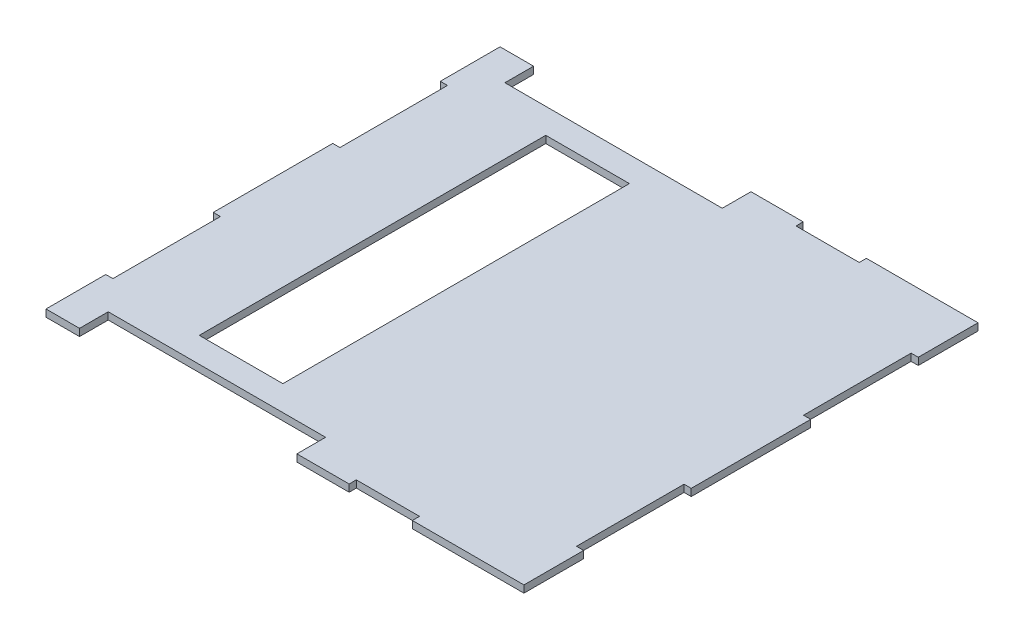
from build123d import *

# Parameters (mm, degrees)
SKETCH1_W               = 200
SKETCH1_H               = 190
BOSS_EXTRUDE1_DEPTH     = 3
CUT_EXTRUDE2_DEPTH      = 138.963763358
CUT_EXTRUDE2_DEPTH_BACK = 3
SKETCH2_OUTSIDE_W       = 257.176
SKETCH2_OUTSIDE_H       = 247.176
SKETCH3_W               = 35
SKETCH3_H               = 145
CUT_EXTRUDE3_DEPTH      = 3
SKETCH4_W               = 90.968696296
SKETCH4_H               = 12
CUT_EXTRUDE4_DEPTH      = 3
SKETCH6_W               = 26.456316212
SKETCH6_H               = 3
CUT_EXTRUDE5_DEPTH      = 3


with BuildPart() as part:
    # Sketch1 → Boss-Extrude1 (new body)
    with BuildSketch(Plane(origin=(0, 0, 0), x_dir=(1, 0, 0), z_dir=(0, 1, 0))):
        Rectangle(SKETCH1_W, SKETCH1_H)
    extrude(amount=BOSS_EXTRUDE1_DEPTH)

    # Sketch2 outside → Cut-Extrude2 (cut, two sides: drawn at the far end of the back side and taken through both)
    with BuildSketch(Plane(origin=(0, 3, 0), x_dir=(1, 0, 0), z_dir=(0, 1, 0)).offset(-CUT_EXTRUDE2_DEPTH_BACK)):
        Rectangle(SKETCH2_OUTSIDE_W, SKETCH2_OUTSIDE_H)
        Polygon((-100, -95), (-100, -70), (-97, -70), (-97, -25), (-100, -25), (-100, 25), (-97, 25), (-97, 70), (-100, 70), (-100, 95), (100, 95), (100, 70), (97, 70), (97, 25), (100, 25), (100, -25), (97, -25), (97, -70), (100, -70), (100, -95), align=None, mode=Mode.SUBTRACT)
    extrude(amount=CUT_EXTRUDE2_DEPTH + CUT_EXTRUDE2_DEPTH_BACK, mode=Mode.SUBTRACT)

    # Sketch3 → Cut-Extrude3 (cut)
    with BuildSketch(Plane(origin=(0, 3, 0), x_dir=(1, 0, 0), z_dir=(0, 1, 0))):
        with Locations((-40.873559806, 0)):
            Rectangle(SKETCH3_W, SKETCH3_H)
    extrude(amount=-CUT_EXTRUDE3_DEPTH, mode=Mode.SUBTRACT)

    # Sketch4 → Cut-Extrude4 (cut)
    with BuildSketch(Plane(origin=(0, 3, 0), x_dir=(1, 0, 0), z_dir=(0, 1, 0))):
        with Locations((-40.484348148, 89)):
            Rectangle(SKETCH4_W, SKETCH4_H)
        with Locations((-40.484348148, -89)):
            Rectangle(SKETCH4_W, SKETCH4_H)
    extrude(amount=-CUT_EXTRUDE4_DEPTH, mode=Mode.SUBTRACT)

    # Sketch6 → Cut-Extrude5 (cut)
    with BuildSketch(Plane.XY.offset(95)):
        with Locations((40.079944256, 1.5)):
            Rectangle(SKETCH6_W, SKETCH6_H)
        Polygon((28.711773307, -23.399830076), (27.78877695, -20.614939543), (57.834413552, -10.656913259), (58.805651465, -13.58735957), align=None)
    cut_extrude5 = extrude(amount=-CUT_EXTRUDE5_DEPTH, mode=Mode.SUBTRACT)

    # Mirror1: Cut-Extrude5 across plane
    add(cut_extrude5.mirror(Plane.XY), mode=Mode.SUBTRACT)


solid = part.part
